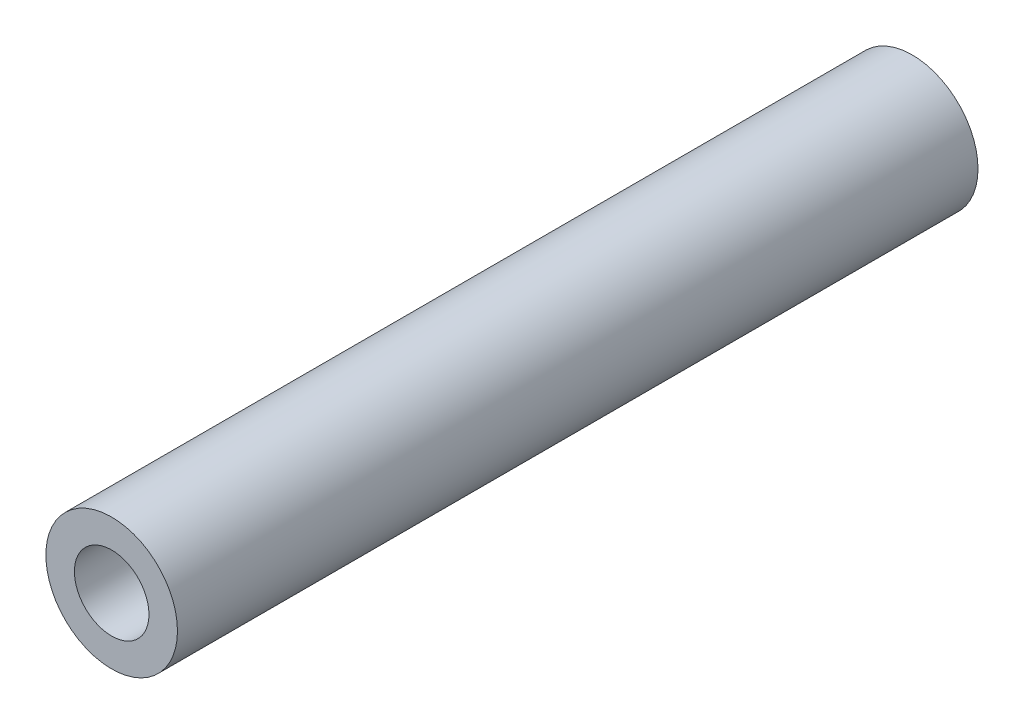
from build123d import *

# Parameters (mm, degrees)
SKETCH1_R           = 3
SKETCH1_R_2         = 1.7
RING_ENVELOPE_DEPTH = 36.5


with BuildPart() as part:
    # Sketch1 → Ring_Envelope (new body)
    with BuildSketch(Plane.XY):
        Circle(SKETCH1_R)
        Circle(SKETCH1_R_2, mode=Mode.SUBTRACT)
    extrude(amount=RING_ENVELOPE_DEPTH)


solid = part.part
